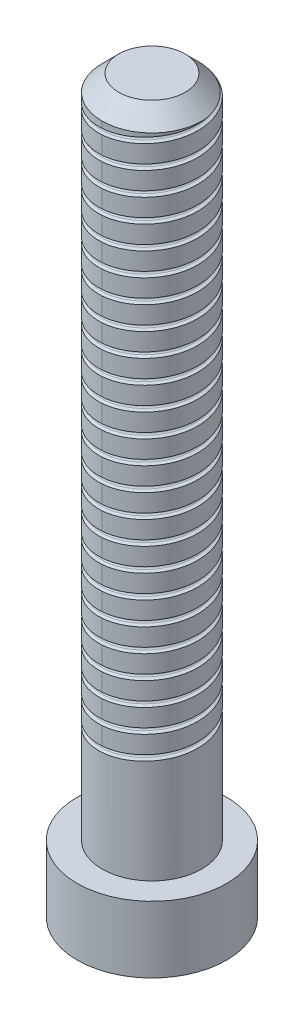
from build123d import *

# Parameters (mm, degrees)
SKETCH1_R              = 2.25
BOSS_EXTRUDE1_DEPTH    = 22
SKETCH2_OUTSIDE_W      = 11.08
SKETCH2_OUTSIDE_H      = 11.08
SKETCH2_OUTSIDE_R      = 1.5
CUT_EXTRUDE1_DEPTH     = 20
CHAMFER1_SIZE          = 0.5
CUT_SWEEP1_PITCH       = 0.7
CUT_SWEEP1_HEIGHT      = 17
CUT_SWEEP1_RADIUS      = 1.5
CUT_SWEEP1_START_ANGLE = 180
CUT_EXTRUDE2_DEPTH     = 1.5


with BuildPart() as part:
    # Sketch1 → Boss-Extrude1 (new body)
    with BuildSketch(Plane(origin=(0, 0, 0), x_dir=(1, 0, 0), z_dir=(0, 1, 0))):
        with Locations(Location((0, 0, 0), (0, 0, 270))):
            Circle(SKETCH1_R)
    extrude(amount=BOSS_EXTRUDE1_DEPTH)

    # Sketch2 outside → Cut-Extrude1 (cut)
    with BuildSketch(Plane(origin=(0, 22, 0), x_dir=(1, 0, 0), z_dir=(0, 1, 0))):
        Rectangle(SKETCH2_OUTSIDE_W, SKETCH2_OUTSIDE_H)
        with Locations(Location((0, 0, 0), (0, 0, 270))):
            Circle(SKETCH2_OUTSIDE_R, mode=Mode.SUBTRACT)
    extrude(amount=-CUT_EXTRUDE1_DEPTH, mode=Mode.SUBTRACT)

    # Chamfer1
    chamfer1_edges = [part.edges().sort_by_distance(p)[0] for p in [
        (0, 22, -1.5),
    ]]
    chamfer(chamfer1_edges, length=CHAMFER1_SIZE)

    # Cut-Sweep1: sweep along a helix
    with BuildLine() as cut_sweep1_path:
        add(Helix(CUT_SWEEP1_PITCH, CUT_SWEEP1_HEIGHT, CUT_SWEEP1_RADIUS, center=(0, 22, 0), direction=(0, -1, 0), mode=Mode.PRIVATE).rotate(Axis((0, 22, 0), (0, -1, 0)), CUT_SWEEP1_START_ANGLE))
    # Sketch7 → Cut-Sweep1 (sweep, cut)
    with BuildSketch(Plane(origin=(0, 22, 1.5), x_dir=(0, 0, 1), z_dir=(-0.9972531714167715, -0.07406829348102623, 0))):
        with BuildLine():
            Line((-0.081023547, -0.030253267), (0.549038106, 0.274742329))
            Line((0.549038106, 0.274742329), (0.549038106, -0.425257671))
            Line((0.549038106, -0.425257671), (-0.081023547, -0.120262075))
            ThreePointArc((-0.081023547, -0.120262075), (-0.109238147, -0.075257671), (-0.081023547, -0.030253267))
        make_face()
    sweep(path=cut_sweep1_path.line, is_frenet=True, mode=Mode.SUBTRACT)

    # Sketch8 → Cut-Extrude2 (cut)
    with BuildSketch(Plane.XZ):
        Polygon((1.154700538, 0), (0.577350269, 1), (-0.577350269, 1), (-1.154700538, 0), (-0.577350269, -1), (0.577350269, -1), align=None)
    extrude(amount=-CUT_EXTRUDE2_DEPTH, mode=Mode.SUBTRACT)


solid = part.part
